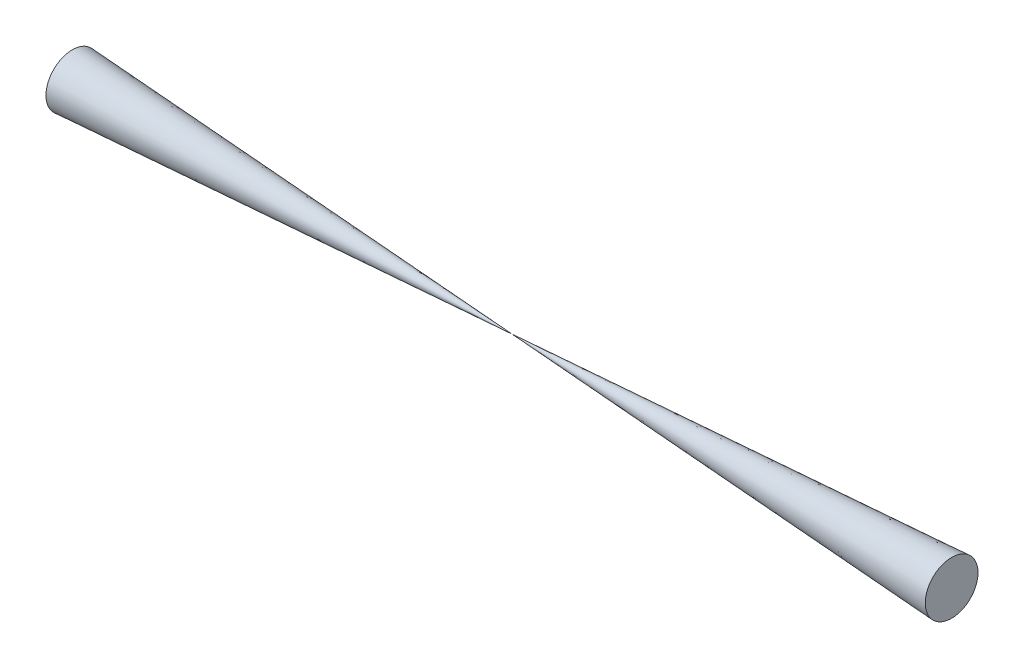
from build123d import *


with BuildPart() as part:
    # 草图1 → 旋转1 (revolve)
    with BuildSketch(Plane(origin=(0, 0, 0), x_dir=(1, 0, 0), z_dir=(0, 1, 0))):
        Polygon((0, 0), (0, 0.01), (200, 12), (200, 0), align=None)
    revolve_1 = revolve(axis=Axis((200, 0, 0), (-1, 0, 0)))

    # 镜向1: 旋转1 across plane
    add(revolve_1.mirror(Plane.ZY))


solid = part.part
